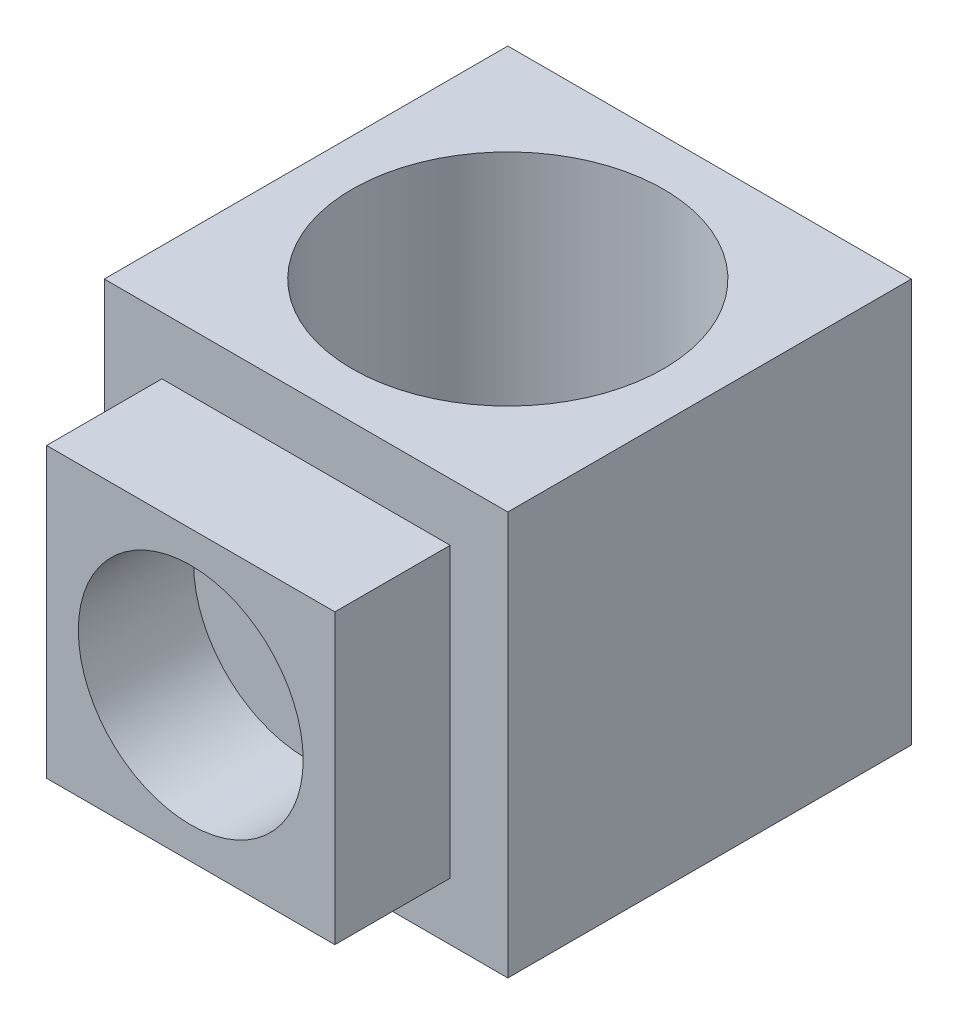
from build123d import *

# Parameters (mm, degrees)
SKETCH_1_W          = 14
SKETCH_1_H          = 14
EXTRUDE_1_DEPTH     = 14
SKETCH_2_W          = 10
SKETCH_2_H          = 10
SKETCH_2_R          = 3.9
EXTRUDE_2_DEPTH     = 4
SKETCH_3_R          = 5.4
CUT_EXTRUDE_1_DEPTH = 14


with BuildPart() as part:
    # 草图1 → 凸台-拉伸1 (new body)
    with BuildSketch(Plane(origin=(0, 0, 0), x_dir=(1, 0, 0), z_dir=(0, 1, 0))):
        with Locations((7, 7)):
            Rectangle(SKETCH_1_W, SKETCH_1_H)
    extrude(amount=EXTRUDE_1_DEPTH)

    # 草图2 → 凸台-拉伸2 (add)
    with BuildSketch(Plane.XY):
        with Locations((7, 7)):
            Rectangle(SKETCH_2_W, SKETCH_2_H)
        with Locations((7, 7)):
            Circle(SKETCH_2_R, mode=Mode.SUBTRACT)
    extrude(amount=EXTRUDE_2_DEPTH)

    # 草图3 → 切除-拉伸1 (cut)
    with BuildSketch(Plane(origin=(0, 14, 0), x_dir=(1, 0, 0), z_dir=(0, 1, 0))):
        with Locations(Location((7, 7, 0), (0, 0, 270))):
            Circle(SKETCH_3_R)
    extrude(amount=-CUT_EXTRUDE_1_DEPTH, mode=Mode.SUBTRACT)


solid = part.part
